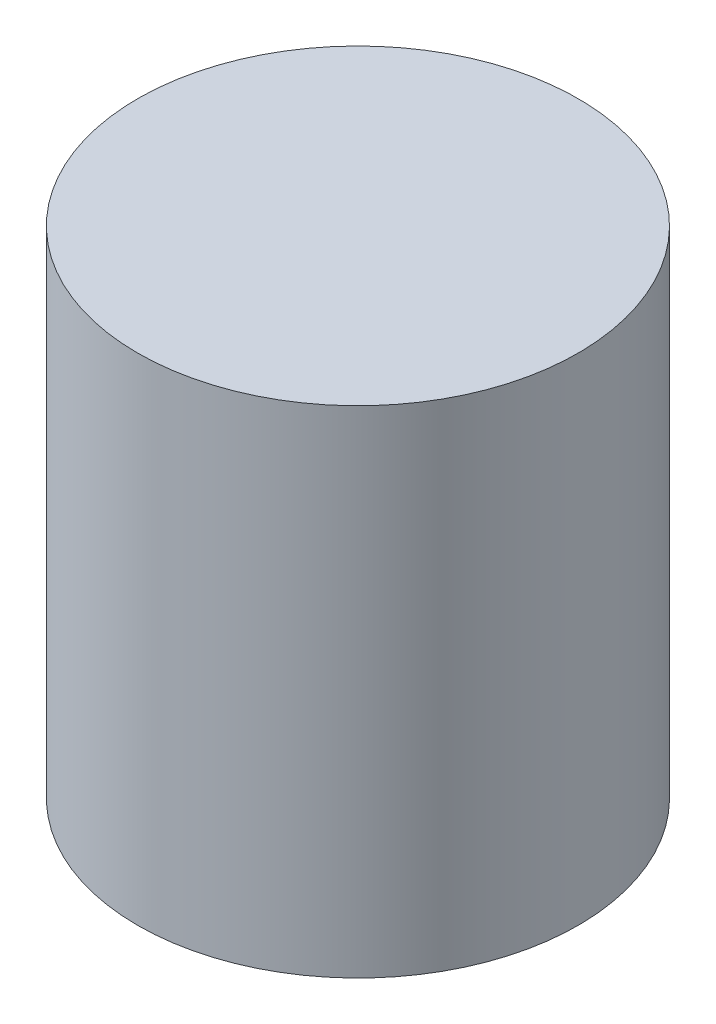
from build123d import *

# Parameters (mm, degrees)
SKETCH_1_R          = 21.625
EXTRUDE_1_DEPTH     = 48.65
SKETCH_2_R          = 19.625
CUT_EXTRUDE_1_DEPTH = 46.65


with BuildPart() as part:
    # Эскиз1 → Бобышка-Вытянуть1 (new body)
    with BuildSketch(Plane(origin=(0, 0, 0), x_dir=(1, 0, 0), z_dir=(0, 1, 0))):
        with Locations(Location((0, 0, 0), (0, 0, 270))):
            Circle(SKETCH_1_R)
    extrude(amount=EXTRUDE_1_DEPTH)

    # Эскиз2 → Вырез-Вытянуть1 (cut)
    with BuildSketch(Plane.XZ):
        with Locations(Location((0, 0, 0), (0, 0, 270))):
            Circle(SKETCH_2_R)
    extrude(amount=-CUT_EXTRUDE_1_DEPTH, mode=Mode.SUBTRACT)


solid = part.part
